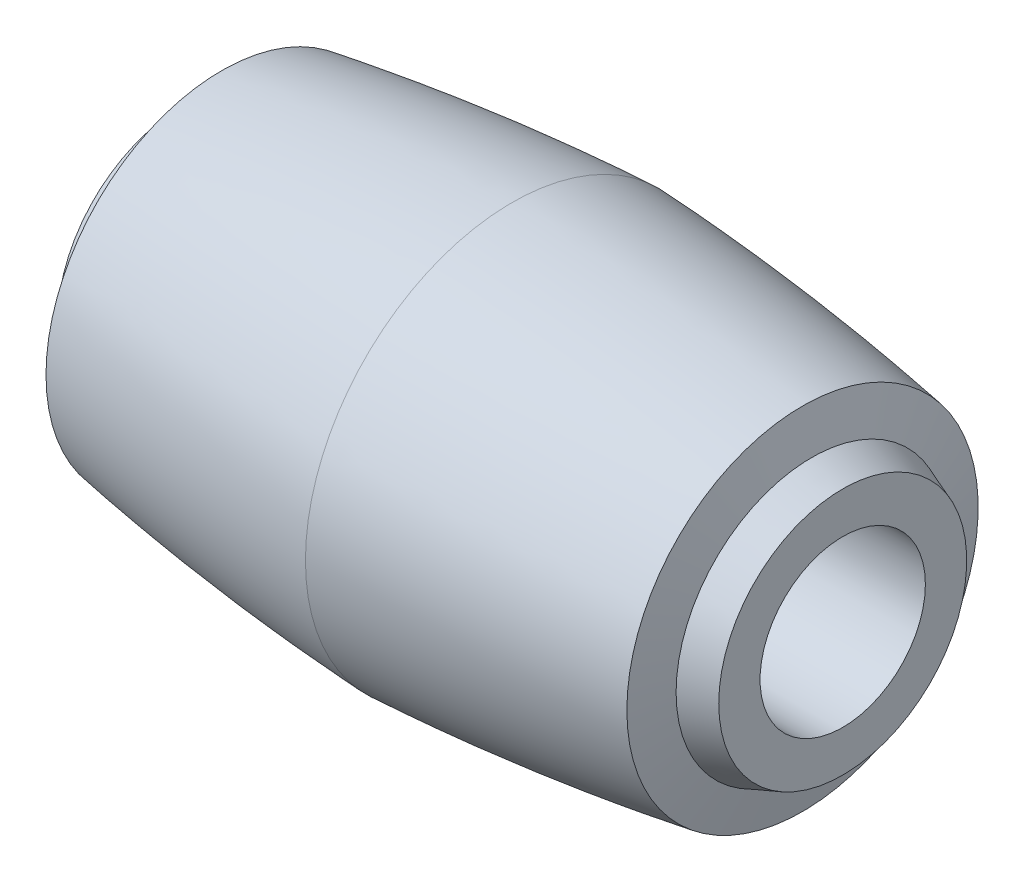
from build123d import *

# Parameters (mm, degrees)
SKETCH7_R          = 4
CUT_EXTRUDE1_DEPTH = 35.985711426


with BuildPart() as part:
    # Sketch3 → Revolve1 (revolve)
    with BuildSketch(Plane.XY, mode=Mode.PRIVATE) as revolve1_sk:
        with BuildLine():
            Line((16, 0), (16, 6))
            Line((16, 6), (14.5, 6.563937783))
            Line((14.5, 6.563937783), (14.054189606, 8.5))
            add(Edge.make_bspline(
                [(0, 10), (7.077462611, 9.64983273), (14.054189606, 8.5)],
                knots=[0, 0, 0, 1, 1, 1], degree=2))
            Line((0, 10), (0, 0))
            Line((0, 0), (16, 0))
        make_face()
    revolve1 = revolve(revolve1_sk.sketch.rotate(Axis((0, 0, 0), (1, 0, 0)), 90), axis=Axis((0, 0, 0), (1, 0, 0)))

    # Mirror1: Revolve1 across plane
    add(revolve1.mirror(Plane(origin=(0, 10, 0), x_dir=(0, 0, 1), z_dir=(1, 0, 0))))

    # Sketch7 → Cut-Extrude1 (cut, through all)
    with BuildSketch(Plane(origin=(16, 0, 0), x_dir=(0, 0, -1), z_dir=(1, 0, 0))):
        Circle(SKETCH7_R)
    extrude(amount=-CUT_EXTRUDE1_DEPTH, mode=Mode.SUBTRACT)


solid = part.part
